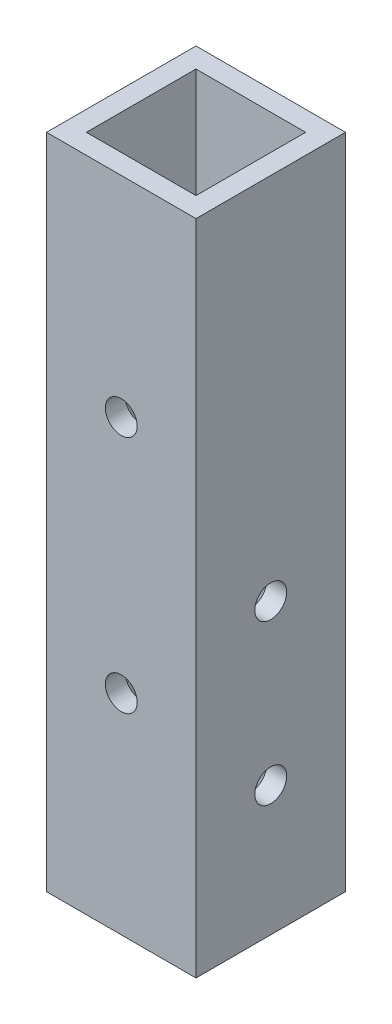
from build123d import *

# Parameters (mm, degrees)
SKETCH1_W           = 15
SKETCH1_H           = 15
SKETCH1_W_2         = 11
SKETCH1_H_2         = 11
BOSS_EXTRUDE1_DEPTH = 66
SKETCH3_R           = 1.6
CUT_EXTRUDE1_DEPTH  = 70.32532005
SKETCH4_R           = 1.6
CUT_EXTRUDE2_DEPTH  = 70.32532005


with BuildPart() as part:
    # Sketch1 → Boss-Extrude1 (new body)
    with BuildSketch(Plane(origin=(0, 0, 0), x_dir=(1, 0, 0), z_dir=(0, 1, 0))):
        with Locations((7.5, 7.5)):
            Rectangle(SKETCH1_W, SKETCH1_H)
        with Locations((7.5, 7.5)):
            Rectangle(SKETCH1_W_2, SKETCH1_H_2, mode=Mode.SUBTRACT)
    extrude(amount=BOSS_EXTRUDE1_DEPTH)

    # Sketch3 → Cut-Extrude1 (cut, through all)
    with BuildSketch(Plane(origin=(0, 0, -15), x_dir=(-1, 0, 0), z_dir=(0, 0, -1))):
        with Locations((-7.5, 21)):
            Circle(SKETCH3_R)
        with Locations((-7.5, 45)):
            Circle(SKETCH3_R)
    extrude(amount=-CUT_EXTRUDE1_DEPTH, mode=Mode.SUBTRACT)

    # Sketch4 → Cut-Extrude2 (cut, through all)
    with BuildSketch(Plane.ZY):
        with Locations((-7.5, 13)):
            Circle(SKETCH4_R)
        with Locations((-7.5, 29)):
            Circle(SKETCH4_R)
    extrude(amount=-CUT_EXTRUDE2_DEPTH, mode=Mode.SUBTRACT)


solid = part.part
